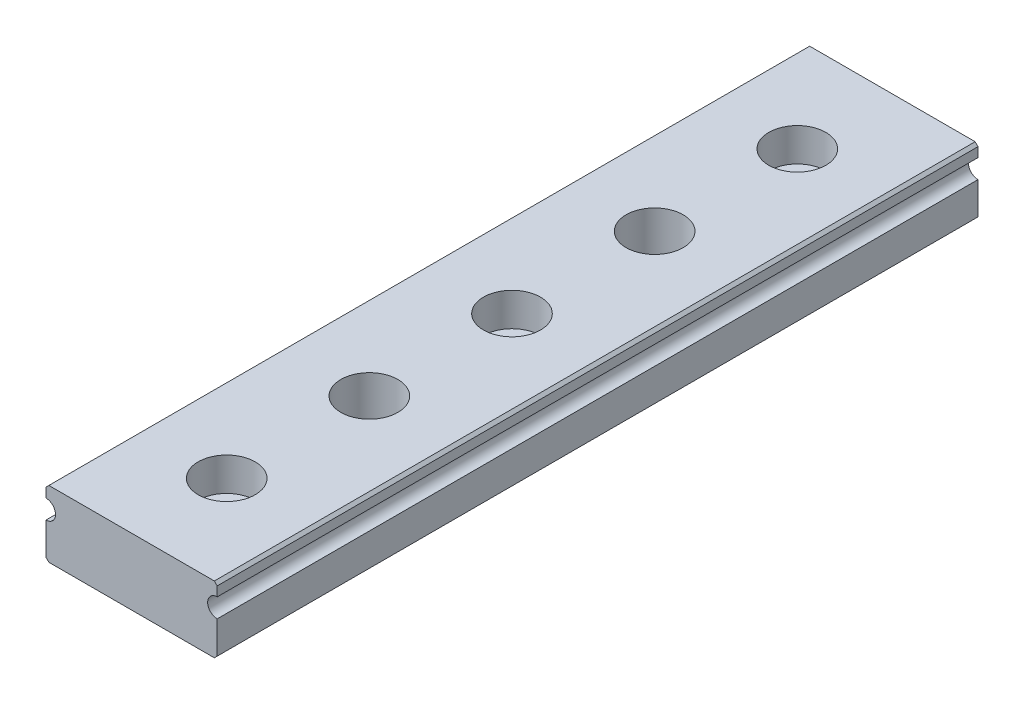
from build123d import *

# Parameters (mm, degrees)
ESBO_O1_W                                            = 18
ESBO_O1_H                                            = 80
RESSALTO_EXTRUS_O1_DEPTH                             = 7
FURO_DE_DI_METRO_2_0_2_1_D                           = 2
FURO_DE_DI_METRO_6_0_6_1_D                           = 6
REBAIXO_PARA_PARAFUSO_DE_M_QUINA_DE_CABE_D           = 3.5
REBAIXO_PARA_PARAFUSO_DE_M_QUINA_DE_CABE_CBORE_D     = 6
REBAIXO_PARA_PARAFUSO_DE_M_QUINA_DE_CABE_CBORE_DEPTH = 3.5
PADR_O_LINEAR1_COUNT                                 = 2
PADR_O_LINEAR1_PITCH                                 = 30
PADR_O_LINEAR2_COUNT                                 = 3
PADR_O_LINEAR2_PITCH                                 = 30
CHANFRO1_SIZE                                        = 0.3


with BuildPart() as part:
    # Esboço1 → Ressalto-extrusão1 (new body)
    with BuildSketch(Plane.XZ):
        with Locations((-9, -40)):
            Rectangle(ESBO_O1_W, ESBO_O1_H)
    extrude(amount=-RESSALTO_EXTRUS_O1_DEPTH)

    # Furo de diâmetro Ø2.0 (2)1 (through all)
    with Locations(Plane(origin=(0, 0, -80), x_dir=(-1, 0, 0), z_dir=(0, 0, -1))):
        with Locations((0, 4.7), (18, 4.7)):
            Hole(FURO_DE_DI_METRO_2_0_2_1_D / 2)

    # Furo de diâmetro Ø6.0 (6)1 (through all)
    with Locations(Plane(origin=(0, 7, 0), x_dir=(1, 0, 0), z_dir=(0, 1, 0))):
        with Locations((-9, 25)):
            furo_de_di_metro_6_0_6_1 = Hole(FURO_DE_DI_METRO_6_0_6_1_D / 2)

    # Rebaixo para parafuso de máquina de cabeça sextavada de M31 (through all)
    with Locations(Plane(origin=(0, 7, 0), x_dir=(1, 0, 0), z_dir=(0, 1, 0))):
        with Locations((-9, 10)):
            rebaixo_para_parafuso_de_m_quina_de_cabe = CounterBoreHole(REBAIXO_PARA_PARAFUSO_DE_M_QUINA_DE_CABE_D / 2, REBAIXO_PARA_PARAFUSO_DE_M_QUINA_DE_CABE_CBORE_D / 2, REBAIXO_PARA_PARAFUSO_DE_M_QUINA_DE_CABE_CBORE_DEPTH)

    # Padrão linear1: Furo de diâmetro Ø6.0 (6)1 ×2
    with Locations(*[(0, 0, -i * PADR_O_LINEAR1_PITCH) for i in range(1, PADR_O_LINEAR1_COUNT)]):
        add(furo_de_di_metro_6_0_6_1, mode=Mode.SUBTRACT)

    # Padrão linear2: Rebaixo para parafuso de máquina de cabeça sextavada de M31 ×3
    with Locations(*[(0, 0, -i * PADR_O_LINEAR2_PITCH) for i in range(1, PADR_O_LINEAR2_COUNT)]):
        add(rebaixo_para_parafuso_de_m_quina_de_cabe, mode=Mode.SUBTRACT)

    # Chanfro1
    chanfro1_edges = [part.edges().sort_by_distance(p)[0] for p in [
        (0, 7, -40),
        (-18, 7, -40),
        (0, 0, -40),
        (-18, 0, -40),
    ]]
    chamfer(chanfro1_edges, length=CHANFRO1_SIZE)


solid = part.part
